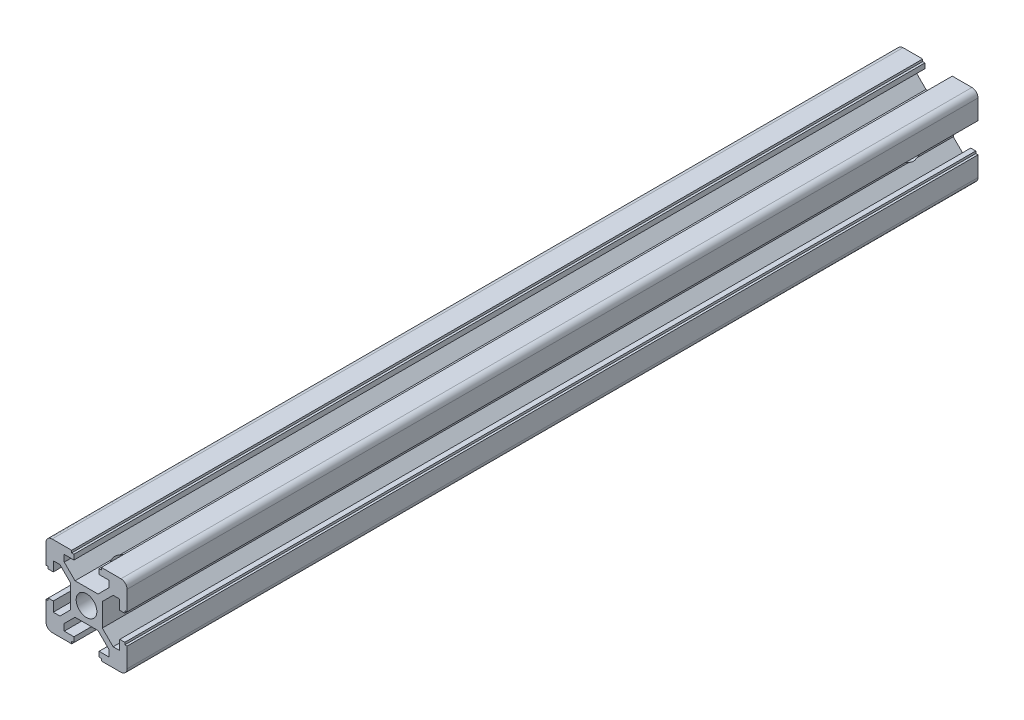
from build123d import *

# Parameters (mm, degrees)
SKETCH_2_R          = 2.55
EXTRUDE_1_DEPTH     = 210
SKETCH_3_R          = 3
CUT_EXTRUDE_1_DEPTH = 212.187120819
SKETCH_4_R          = 3
CUT_EXTRUDE_2_DEPTH = 212.187120919
SKETCH_5_R          = 2.5
CUT_EXTRUDE_3_DEPTH = 212.187120919


with BuildPart() as part:
    # 草图2 → 凸台-拉伸1 (new body)
    with BuildSketch(Plane.XY):
        with BuildLine():
            Line((-3.9, 2.839339828), (-6.560660172, 5.5))
            Line((-6.560660172, 5.5), (-8.2, 5.5))
            Line((-8.2, 5.5), (-8.2, 3.1))
            Line((-8.2, 3.1), (-9.45, 3.1))
            Line((-9.45, 3.1), (-9.45, 3.65))
            Line((-9.45, 3.65), (-10, 3.65))
            Line((-10, 3.65), (-10, 8.5))
            ThreePointArc((-10, 8.5), (-9.560660172, 9.560660172), (-8.5, 10))
            Line((-8.5, 10), (-3.65, 10))
            Line((-3.65, 10), (-3.65, 9.45))
            Line((-3.65, 9.45), (-3.1, 9.45))
            Line((-3.1, 9.45), (-3.1, 8.2))
            Line((-3.1, 8.2), (-5.5, 8.2))
            Line((-5.5, 8.2), (-5.5, 6.560660172))
            Line((-5.5, 6.560660172), (-2.839339828, 3.9))
            Line((-2.839339828, 3.9), (2.839339828, 3.9))
            Line((2.839339828, 3.9), (5.5, 6.560660172))
            Line((5.5, 6.560660172), (5.5, 8.2))
            Line((5.5, 8.2), (3.1, 8.2))
            Line((3.1, 8.2), (3.1, 9.45))
            Line((3.1, 9.45), (3.65, 9.45))
            Line((3.65, 9.45), (3.65, 10))
            Line((3.65, 10), (8.5, 10))
            ThreePointArc((8.5, 10), (9.560660172, 9.560660172), (10, 8.5))
            Line((10, 8.5), (10, 3.65))
            Line((10, 3.65), (9.45, 3.65))
            Line((9.45, 3.65), (9.45, 3.1))
            Line((9.45, 3.1), (8.2, 3.1))
            Line((8.2, 3.1), (8.2, 5.5))
            Line((8.2, 5.5), (6.560660172, 5.5))
            Line((6.560660172, 5.5), (3.9, 2.839339828))
            Line((3.9, 2.839339828), (3.9, -2.839339828))
            Line((3.9, -2.839339828), (6.560660172, -5.5))
            Line((6.560660172, -5.5), (8.2, -5.5))
            Line((8.2, -5.5), (8.2, -3.1))
            Line((8.2, -3.1), (9.45, -3.1))
            Line((9.45, -3.1), (9.45, -3.65))
            Line((9.45, -3.65), (10, -3.65))
            Line((10, -3.65), (10, -8.5))
            ThreePointArc((10, -8.5), (9.560660172, -9.560660172), (8.5, -10))
            Line((8.5, -10), (3.65, -10))
            Line((3.65, -10), (3.65, -9.45))
            Line((3.65, -9.45), (3.1, -9.45))
            Line((3.1, -9.45), (3.1, -8.2))
            Line((3.1, -8.2), (5.5, -8.2))
            Line((5.5, -8.2), (5.5, -6.560660172))
            Line((5.5, -6.560660172), (2.839339828, -3.9))
            Line((2.839339828, -3.9), (-2.839339828, -3.9))
            Line((-2.839339828, -3.9), (-5.5, -6.560660172))
            Line((-5.5, -6.560660172), (-5.5, -8.2))
            Line((-5.5, -8.2), (-3.1, -8.2))
            Line((-3.1, -8.2), (-3.1, -9.45))
            Line((-3.1, -9.45), (-3.65, -9.45))
            Line((-3.65, -9.45), (-3.65, -10))
            Line((-3.65, -10), (-8.5, -10))
            ThreePointArc((-8.5, -10), (-9.560660172, -9.560660172), (-10, -8.5))
            Line((-10, -8.5), (-10, -3.65))
            Line((-10, -3.65), (-9.45, -3.65))
            Line((-9.45, -3.65), (-9.45, -3.1))
            Line((-9.45, -3.1), (-8.2, -3.1))
            Line((-8.2, -3.1), (-8.2, -5.5))
            Line((-8.2, -5.5), (-6.560660172, -5.5))
            Line((-6.560660172, -5.5), (-3.9, -2.839339828))
            Line((-3.9, -2.839339828), (-3.9, 2.839339828))
        make_face()
        Circle(SKETCH_2_R, mode=Mode.SUBTRACT)
    extrude(amount=EXTRUDE_1_DEPTH)

    # 草图3 → 切除-拉伸1 (cut, through all)
    with BuildSketch(Plane.YZ.offset(-10)):
        with Locations(Location((0, 10, 0), (0, 0, 161.164003842))):
            Circle(SKETCH_3_R)
    extrude(amount=CUT_EXTRUDE_1_DEPTH, mode=Mode.SUBTRACT)

    # 草图4 → 切除-拉伸2 (cut, through all)
    with BuildSketch(Plane.XZ.offset(10)):
        with Locations(Location((0, 200, 0), (0, 0, 341.164003842))):
            Circle(SKETCH_4_R)
    extrude(amount=-CUT_EXTRUDE_2_DEPTH, mode=Mode.SUBTRACT)

    # 草图5 → 切除-拉伸3 (cut, through all)
    with BuildSketch(Plane.ZY.offset(10)):
        with Locations(Location((101, 0, 0), (0, 0, 270))):
            Circle(SKETCH_5_R)
        with Locations(Location((142, 0, 0), (0, 0, 270))):
            Circle(SKETCH_5_R)
    extrude(amount=-CUT_EXTRUDE_3_DEPTH, mode=Mode.SUBTRACT)


solid = part.part
